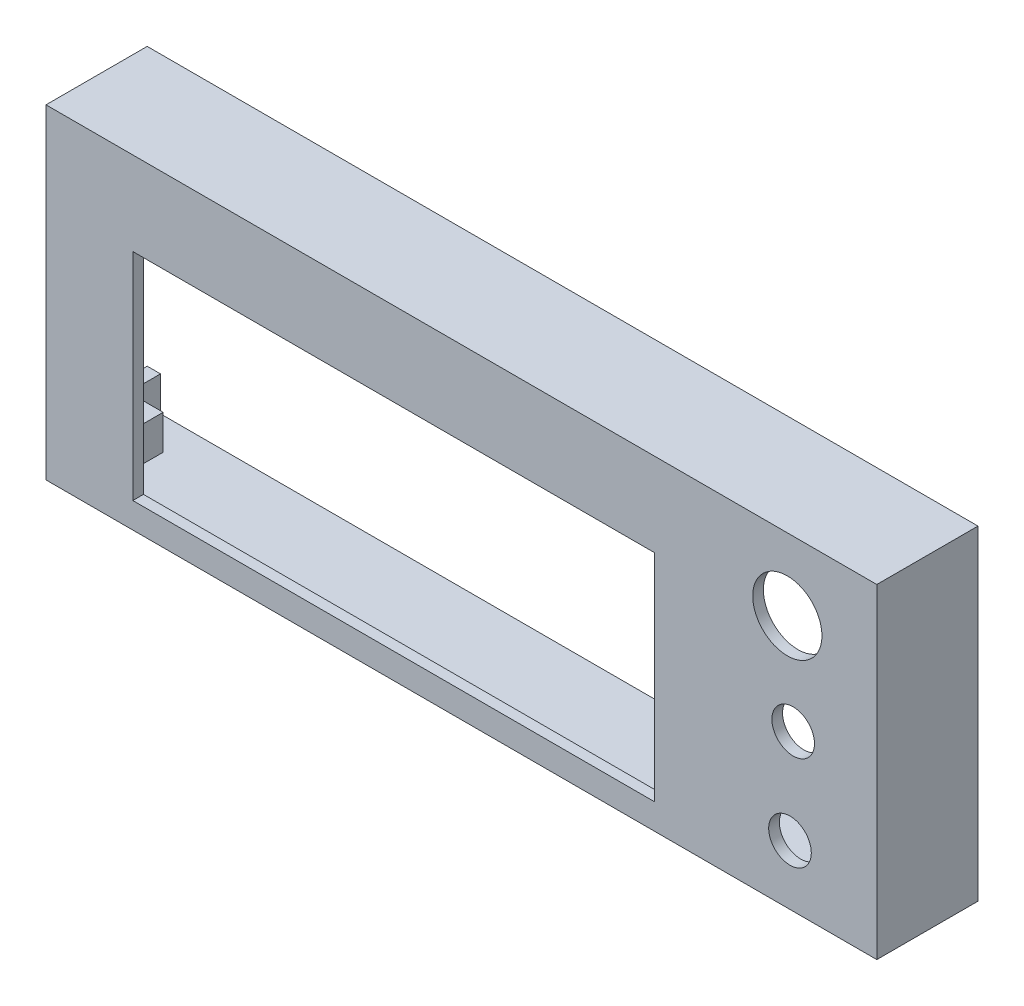
from build123d import *

# Parameters (mm, degrees)
BOSS_EXTRUDE1_DEPTH                                 = 24
SKETCH2_W                                           = 151
SKETCH2_H                                           = 56
CUT_EXTRUDE1_DEPTH                                  = 22
SKETCH3_W                                           = 156
SKETCH3_H                                           = 61
CUT_EXTRUDE2_DEPTH                                  = 5
SKETCH4_R                                           = 6.5
SKETCH4_R_2                                         = 4
SKETCH4_W                                           = 98
SKETCH4_H                                           = 40.5
CUT_EXTRUDE3_DEPTH                                  = 4
CBORE_FOR_M4_HEX_SOCKET_HEAD_CAP_SCREW1_D           = 4.5
CBORE_FOR_M4_HEX_SOCKET_HEAD_CAP_SCREW1_CBORE_D     = 8
CBORE_FOR_M4_HEX_SOCKET_HEAD_CAP_SCREW1_CBORE_DEPTH = 4.4
SKETCH7_W                                           = 6.5
SKETCH7_H                                           = 6.5
BOSS_EXTRUDE2_DEPTH                                 = 11
F_2_0MM_DOWEL_HOLE1_D                               = 2
F_2_0MM_DOWEL_HOLE1_DEPTH                           = 8
F_2_0MM_DOWEL_HOLE1_TIP                             = 0.600860619
SKETCH13_W                                          = 15
SKETCH13_H                                          = 20
CUT_EXTRUDE6_DEPTH                                  = 24
SKETCH14_W                                          = 6
SKETCH14_H                                          = 31
CUT_EXTRUDE7_DEPTH                                  = 3


with BuildPart() as part:
    # Sketch1 → Boss-Extrude1 (new body)
    with BuildSketch(Plane.XY):
        Polygon((-93, 10.5), (-78, 10.5), (-78, -30.5), (78, -30.5), (78, 10.5), (93, 10.5), (93, 30.5), (-93, 30.5), align=None)
    extrude(amount=BOSS_EXTRUDE1_DEPTH)

    # Sketch2 → Cut-Extrude1 (cut)
    with BuildSketch(Plane(origin=(0, 0, 0), x_dir=(-1, 0, 0), z_dir=(0, 0, -1))):
        Rectangle(SKETCH2_W, SKETCH2_H)
    extrude(amount=-CUT_EXTRUDE1_DEPTH, mode=Mode.SUBTRACT)

    # Sketch3 → Cut-Extrude2 (cut)
    with BuildSketch(Plane(origin=(0, 0, 0), x_dir=(-1, 0, 0), z_dir=(0, 0, -1))):
        Rectangle(SKETCH3_W, SKETCH3_H)
    extrude(amount=-CUT_EXTRUDE2_DEPTH, mode=Mode.SUBTRACT)

    # Sketch4 → Cut-Extrude3 (cut)
    with BuildSketch(Plane.XY.offset(24)):
        with Locations((61.2, 17)):
            Circle(SKETCH4_R)
        with Locations((62.3, -1.25)):
            Circle(SKETCH4_R_2)
        with Locations((61.7, -19.3)):
            Circle(SKETCH4_R_2)
        with Locations((-12.7, -5.45)):
            Rectangle(SKETCH4_W, SKETCH4_H)
    extrude(amount=-CUT_EXTRUDE3_DEPTH, mode=Mode.SUBTRACT)

    # CBORE for M4 Hex Socket Head Cap Screw1 (through all)
    with Locations(Plane.XY.offset(24)):
        with Locations((-85, 20.5), (85, 20.376125295)):
            CounterBoreHole(CBORE_FOR_M4_HEX_SOCKET_HEAD_CAP_SCREW1_D / 2, CBORE_FOR_M4_HEX_SOCKET_HEAD_CAP_SCREW1_CBORE_D / 2, CBORE_FOR_M4_HEX_SOCKET_HEAD_CAP_SCREW1_CBORE_DEPTH)

    # Sketch7 → Boss-Extrude2 (add)
    with BuildSketch(Plane(origin=(0, 0, 22), x_dir=(-1, 0, 0), z_dir=(0, 0, -1))):
        with Locations((-72.25, 24.75)):
            Rectangle(SKETCH7_W, SKETCH7_H)
        with Locations((-72.25, -24.75)):
            Rectangle(SKETCH7_W, SKETCH7_H)
        with Locations((72.25, 24.75)):
            Rectangle(SKETCH7_W, SKETCH7_H)
        with Locations((72.25, -24.75)):
            Rectangle(SKETCH7_W, SKETCH7_H)
    extrude(amount=BOSS_EXTRUDE2_DEPTH)

    # Ø2.0mm Dowel Hole1
    with Locations(Plane(origin=(0, 0, 11), x_dir=(-1, 0, 0), z_dir=(0, 0, -1))):
        with Locations((-72.25, 24.75), (-72.25, -24.75), (72.25, 24.75), (72.25, -24.75)):
            Hole(F_2_0MM_DOWEL_HOLE1_D / 2, depth=F_2_0MM_DOWEL_HOLE1_DEPTH)
            with Locations((0, 0, -(F_2_0MM_DOWEL_HOLE1_DEPTH + F_2_0MM_DOWEL_HOLE1_TIP / 2))):  # 118° drill point
                Cone(0, F_2_0MM_DOWEL_HOLE1_D / 2, F_2_0MM_DOWEL_HOLE1_TIP, mode=Mode.SUBTRACT)

    # Sketch13 → Cut-Extrude6 (cut)
    with BuildSketch(Plane(origin=(0, 0, 0), x_dir=(-1, 0, 0), z_dir=(0, 0, -1))):
        with Locations((-85.5, 20.5)):
            Rectangle(SKETCH13_W, SKETCH13_H)
        with Locations((85.5, 20.5)):
            Rectangle(SKETCH13_W, SKETCH13_H)
    extrude(amount=-CUT_EXTRUDE6_DEPTH, mode=Mode.SUBTRACT)

    # Sketch14 → Cut-Extrude7 (cut)
    with BuildSketch(Plane.ZY.offset(78)):
        with Locations((8, -6)):
            Rectangle(SKETCH14_W, SKETCH14_H)
    extrude(amount=-CUT_EXTRUDE7_DEPTH, mode=Mode.SUBTRACT)


solid = part.part
